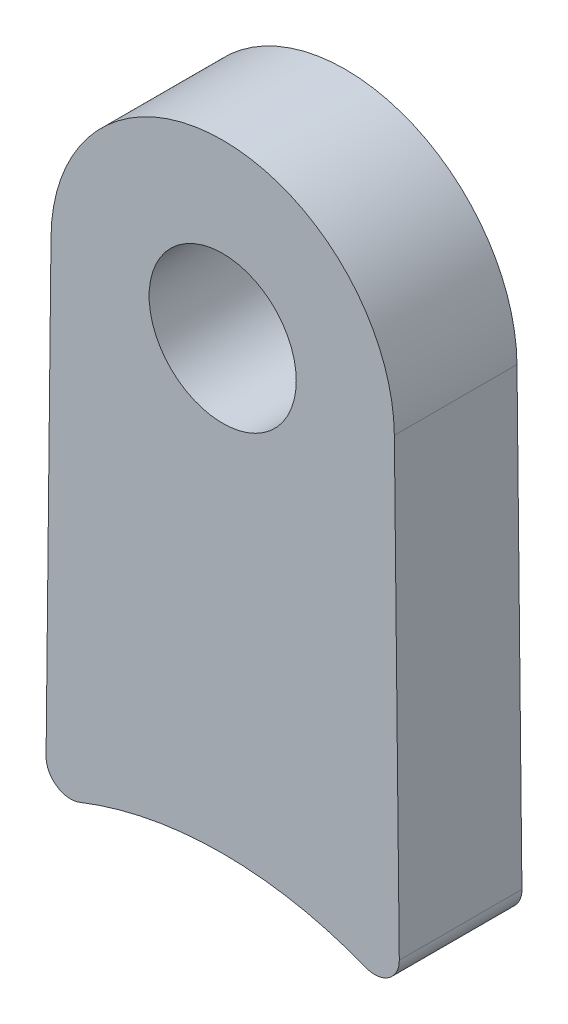
from build123d import *

# Parameters (mm, degrees)
SKETCH1_R           = 3
BOSS_EXTRUDE1_DEPTH = 5
FILLET1_R           = 1


with BuildPart() as part:
    # Sketch1 → Boss-Extrude1 (new body)
    with BuildSketch(Plane.XY):
        with BuildLine():
            Line((-7.217785759, 14.139278402), (-6.99958338, 34.13808806))
            ThreePointArc((-6.99958338, 34.13808806), (0, 41.061717228), (6.99958338, 34.13808806))
            Line((6.99958338, 34.13808806), (7.217785759, 14.139278402))
            ThreePointArc((7.217785759, 14.139278402), (0, 15.875), (-7.217785759, 14.139278402))
        make_face()
        with Locations((0, 34.061717228)):
            Circle(SKETCH1_R, mode=Mode.SUBTRACT)
    extrude(amount=BOSS_EXTRUDE1_DEPTH)

    # Fillet1
    fillet1_edges = [part.edges().sort_by_distance(p)[0] for p in [
        (-7.217785759, 14.139278402, 2.5),
        (7.217785759, 14.139278402, 2.5),
    ]]
    fillet(fillet1_edges, radius=FILLET1_R)


solid = part.part
